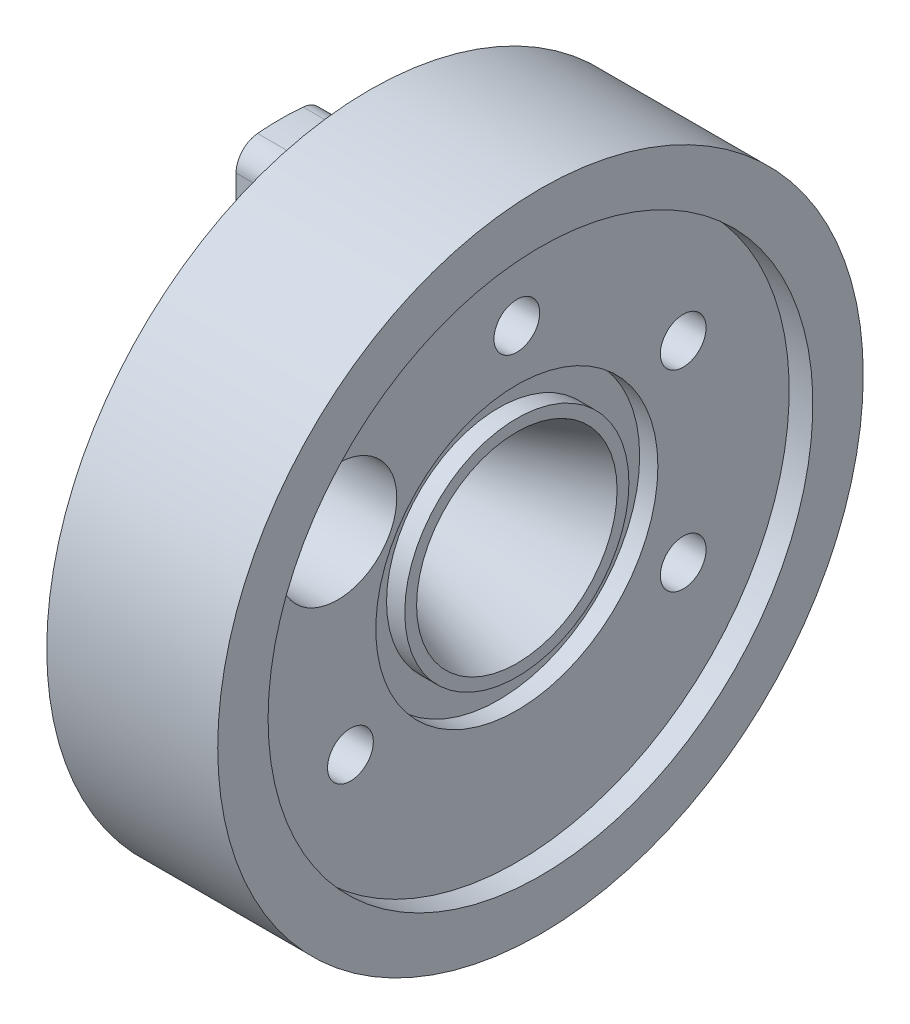
from build123d import *

# Parameters (mm, degrees)
MOUNTING_HOLE_D               = 4.9149
CIRPATTERN1_COUNT             = 3
SKETCH26_R                    = 15.1511
SKETCH26_R_2                  = 12.0396
AXIAL_O_RING_GLAND_DEPTH      = 1.9558
PRESSURE_TAP_CLEARANCE_HOLE_D = 12.7
THERMOCOUPLE_CLEARANCE_HOLE_D = 4.9149
SKETCH7_R                     = 34.7345
CUT_EXTRUDE1_DEPTH            = 9.5758
FILLET1_R                     = 2.54
FILLET2_R                     = 6.604


with BuildPart() as part:
    # Sketch1 → Revolve2 (revolve)
    with BuildSketch(Plane.XY, mode=Mode.PRIVATE) as revolve2_sk:
        Polygon((27.94, 34.671), (9.5758, 34.671), (9.5758, 27.94), (0, 27.94), (0, 0), (25.4, 0), (25.4, 29.2608), (27.94, 29.2608), align=None)
    revolve(revolve2_sk.sketch.rotate(Axis((-88.99, 0, 0), (1, 0, 0)), 90), axis=Axis((-88.99, 0, 0), (1, 0, 0)))

    # Sketch28 → NPT Center Bore (revolve, cut)
    with BuildSketch(Plane.ZX):
        Polygon((0, 0), (0, 27.94), (5.5626, 27.94), (5.5626, 10.16), (6.557974294, 10.16), (6.8621783, 0), align=None)
    revolve(axis=Axis((-6.35, 0, 0), (1, 0, 0)), mode=Mode.SUBTRACT)

    # Mounting Hole (through all)
    with Locations(Plane.ZY):
        with Locations((0, 20.6375)):
            mounting_hole = Hole(MOUNTING_HOLE_D / 2)

    # CirPattern1: Mounting Hole ×3 about axis
    cirpattern1_axis = Axis((0, 0, 0), (1, 0, 0))
    for i in range(1, CIRPATTERN1_COUNT):
        add(mounting_hole.rotate(cirpattern1_axis, i * 360 / CIRPATTERN1_COUNT), mode=Mode.SUBTRACT)

    # Sketch26 → Axial O-Ring Gland (cut)
    with BuildSketch(Plane(origin=(25.4, 0, 0), x_dir=(0, 0, -1), z_dir=(1, 0, 0))):
        Circle(SKETCH26_R)
        Circle(SKETCH26_R_2, mode=Mode.SUBTRACT)
    extrude(amount=-AXIAL_O_RING_GLAND_DEPTH, mode=Mode.SUBTRACT)

    # Sketch30 → Flow Cone (revolve, cut)
    with BuildSketch(Plane.XY, mode=Mode.PRIVATE) as flow_cone_sk:
        Polygon((11.093885077, 5.5626), (25.4, 10.7696), (25.4, 5.5626), align=None)
    revolve(flow_cone_sk.sketch.rotate(Axis((-88.99, 0, 0), (1, 0, 0)), 90), axis=Axis((-88.99, 0, 0), (1, 0, 0)), mode=Mode.SUBTRACT)

    # Pressure Tap Clearance Hole (through all)
    with Locations(Plane.ZY):
        with Locations((19.247414599, 11.1125)):
            Hole(PRESSURE_TAP_CLEARANCE_HOLE_D / 2)

    # Thermocouple Clearance Hole (through all)
    with Locations(Plane.ZY):
        with Locations((-17.872599271, 10.31875)):
            Hole(THERMOCOUPLE_CLEARANCE_HOLE_D / 2)

    # Sketch7 → Cut-Extrude1 (cut)
    with BuildSketch(Plane.ZY):
        Circle(SKETCH7_R)
        with BuildLine():
            Line((15.496152366, -3.447446426), (25.553900006, -9.254289733))
            ThreePointArc((25.553900006, -9.254289733), (23.536838424, -13.589), (20.791400006, -17.503181704))
            Line((20.791400006, -17.503181704), (10.733652366, -11.696338397))
            ThreePointArc((10.733652366, -11.696338397), (0, -15.875), (-10.733652366, -11.696338397))
            Line((-10.733652366, -11.696338397), (-20.791400006, -17.503181704))
            ThreePointArc((-20.791400006, -17.503181704), (-23.536838424, -13.589), (-25.553900006, -9.254289733))
            Line((-25.553900006, -9.254289733), (-15.496152366, -3.447446426))
            ThreePointArc((-15.496152366, -3.447446426), (-13.748153285, 7.9375), (-4.7625, 15.143784822))
            Line((-4.7625, 15.143784822), (-4.7625, 26.757471438))
            ThreePointArc((-4.7625, 26.757471438), (0, 27.178), (4.7625, 26.757471438))
            Line((4.7625, 26.757471438), (4.7625, 15.143784822))
            ThreePointArc((4.7625, 15.143784822), (13.748153285, 7.9375), (15.496152366, -3.447446426))
        make_face(mode=Mode.SUBTRACT)
    extrude(amount=-CUT_EXTRUDE1_DEPTH, mode=Mode.SUBTRACT)

    # Fillet1
    fillet1_edges = [part.edges().sort_by_distance(p)[0] for p in [
        (4.7879, -9.254289733, 25.553900006),
        (4.7879, -17.503181704, 20.791400006),
        (4.7879, -17.503181704, -20.791400006),
        (4.7879, -9.254289733, -25.553900006),
        (4.7879, 26.757471438, -4.7625),
        (4.7879, 26.757471438, 4.7625),
    ]]
    fillet(fillet1_edges, radius=FILLET1_R)

    # Fillet2
    fillet2_edges = [part.edges().sort_by_distance(p)[0] for p in [
        (4.7879, -3.447446426, 15.496152366),
        (4.7879, -11.696338397, 10.733652366),
        (4.7879, -11.696338397, -10.733652366),
        (4.7879, -3.447446426, -15.496152366),
        (4.7879, 15.143784822, -4.7625),
        (4.7879, 15.143784822, 4.7625),
    ]]
    fillet(fillet2_edges, radius=FILLET2_R)


solid = part.part
